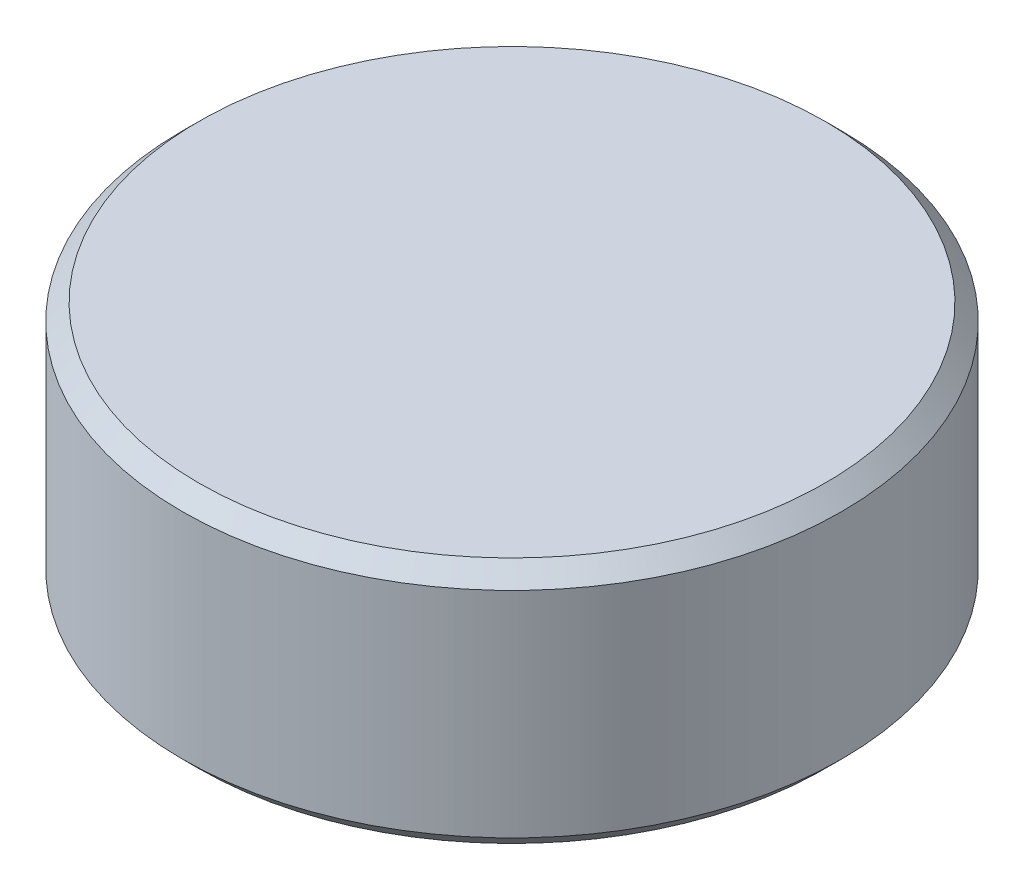
from build123d import *

# Parameters (mm, degrees)
SKETCH1_R           = 2
BOSS_EXTRUDE1_DEPTH = 1.5
CHAMFER1_SIZE       = 0.1


with BuildPart() as part:
    # Sketch1 → Boss-Extrude1 (new body)
    with BuildSketch(Plane(origin=(0, 0, 0), x_dir=(1, 0, 0), z_dir=(0, 1, 0))):
        with Locations(Location((0, 0, 0), (0, 0, 270))):
            Circle(SKETCH1_R)
    extrude(amount=BOSS_EXTRUDE1_DEPTH)

    # Chamfer1
    chamfer1_edges = [part.edges().sort_by_distance(p)[0] for p in [
        (0, 0, -2),
        (0, 1.5, -2),
    ]]
    chamfer(chamfer1_edges, length=CHAMFER1_SIZE)


solid = part.part
